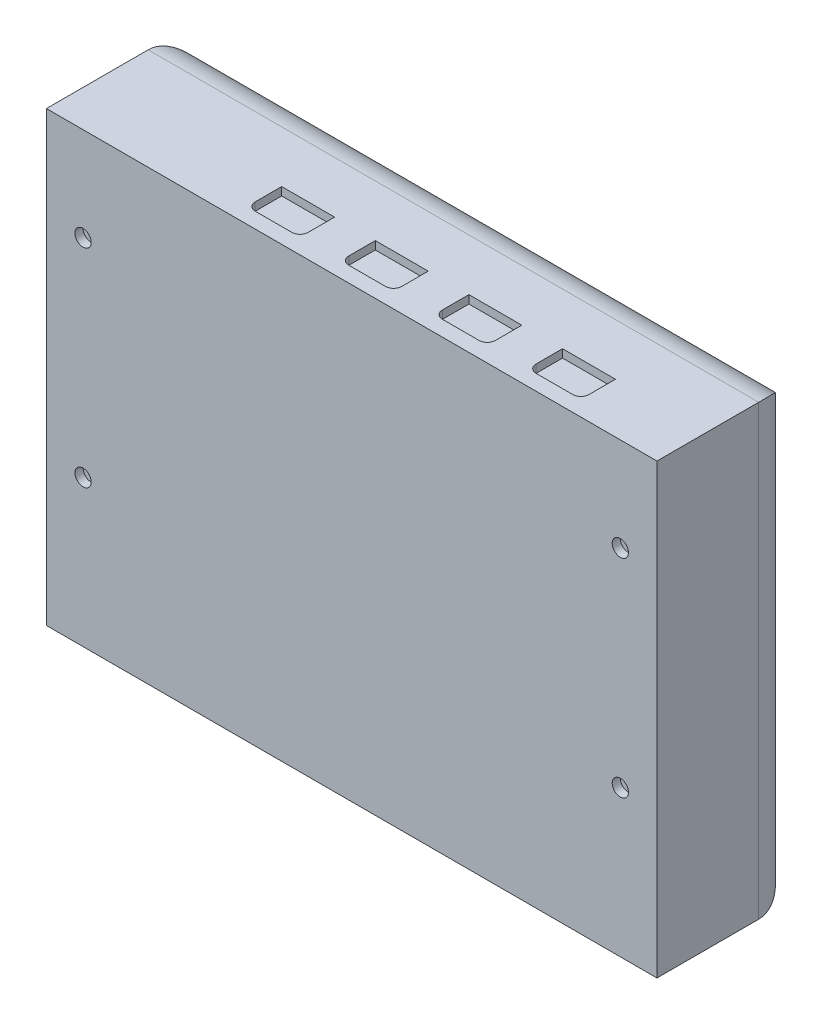
from build123d import *

# Parameters (mm, degrees)
SKETCH_1_W          = 150
SKETCH_1_H          = 110
EXTRUDE_1_DEPTH     = 35
FILLET_1_R          = 10
SKETCH_4_R          = 2
CUT_EXTRUDE_1_DEPTH = 2
CUT_EXTRUDE_2_DEPTH = 2


with BuildPart() as part:
    # 草图1 → 凸台-拉伸1 (new body)
    with BuildSketch(Plane.XY):
        Rectangle(SKETCH_1_W, SKETCH_1_H)
    extrude(amount=EXTRUDE_1_DEPTH)

    # 圆角1
    fillet_1_edges = [part.edges().sort_by_distance(p)[0] for p in [
        (-75, 0, 0),
        (0, -55, 0),
        (75, 0, 0),
        (0, 55, 0),
    ]]
    fillet(fillet_1_edges, radius=FILLET_1_R)

    # 草图4 → 切除-拉伸1 (cut)
    with BuildSketch(Plane.XY.offset(35)):
        with Locations((-66, 32)):
            Circle(SKETCH_4_R)
        with Locations((-66, -19)):
            Circle(SKETCH_4_R)
        with Locations((66, -19)):
            Circle(SKETCH_4_R)
        with Locations((66, 32)):
            Circle(SKETCH_4_R)
    extrude(amount=-CUT_EXTRUDE_1_DEPTH, mode=Mode.SUBTRACT)

    # 草图5 → 切除-拉伸2 (cut)
    with BuildSketch(Plane(origin=(0, 55, 0), x_dir=(1, 0, 0), z_dir=(0, 1, 0))):
        with BuildLine():
            Line((-6.5, -22.7), (6.5, -22.7))
            Line((6.5, -22.7), (6.5, -29.2))
            ThreePointArc((6.5, -29.2), (5.914213562, -30.614213562), (4.5, -31.2))
            Line((4.5, -31.2), (-4.5, -31.2))
            ThreePointArc((-4.5, -31.2), (-5.914213562, -30.614213562), (-6.5, -29.2))
            Line((-6.5, -29.2), (-6.5, -22.7))
        make_face()
        with BuildLine():
            Line((16.5, -22.7), (29.5, -22.7))
            Line((29.5, -22.7), (29.5, -29.2))
            ThreePointArc((29.5, -29.2), (28.914213562, -30.614213562), (27.5, -31.2))
            Line((27.5, -31.2), (18.5, -31.2))
            ThreePointArc((18.5, -31.2), (17.085786438, -30.614213562), (16.5, -29.2))
            Line((16.5, -29.2), (16.5, -22.7))
        make_face()
        with BuildLine():
            Line((39.5, -22.7), (52.5, -22.7))
            Line((52.5, -22.7), (52.5, -29.2))
            ThreePointArc((52.5, -29.2), (51.914213562, -30.614213562), (50.5, -31.2))
            Line((50.5, -31.2), (41.5, -31.2))
            ThreePointArc((41.5, -31.2), (40.085786438, -30.614213562), (39.5, -29.2))
            Line((39.5, -29.2), (39.5, -22.7))
        make_face()
        with BuildLine():
            Line((-29.5, -22.7), (-16.5, -22.7))
            Line((-16.5, -22.7), (-16.5, -29.2))
            ThreePointArc((-16.5, -29.2), (-17.085786438, -30.614213562), (-18.5, -31.2))
            Line((-18.5, -31.2), (-27.5, -31.2))
            ThreePointArc((-27.5, -31.2), (-28.914213562, -30.614213562), (-29.5, -29.2))
            Line((-29.5, -29.2), (-29.5, -22.7))
        make_face()
    extrude(amount=-CUT_EXTRUDE_2_DEPTH, mode=Mode.SUBTRACT)


solid = part.part
